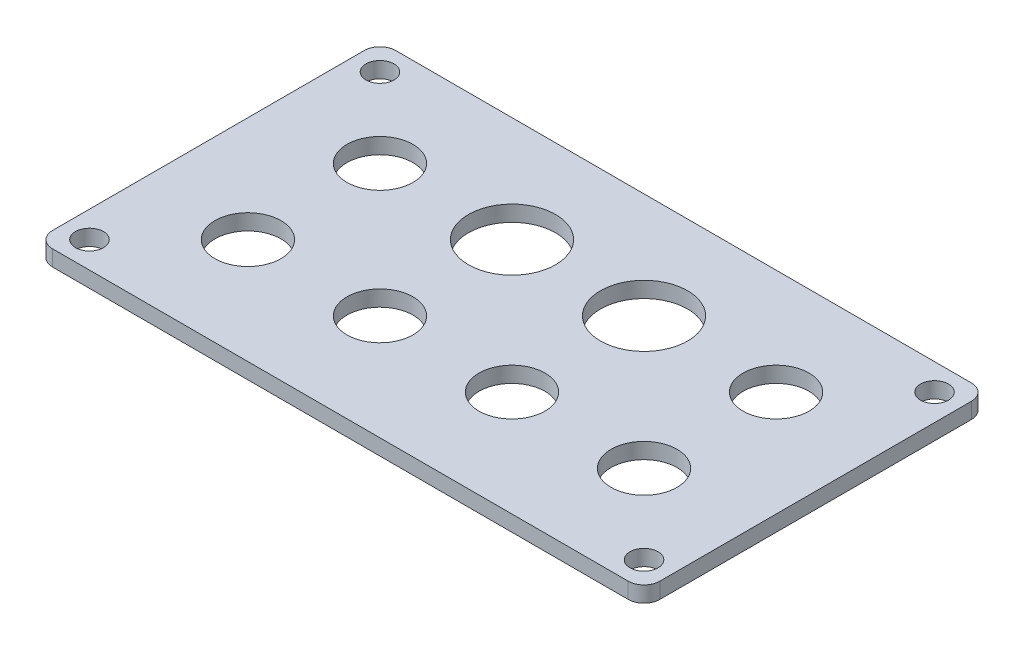
from build123d import *

# Parameters (mm, degrees)
SKETCH1_W            = 115
SKETCH1_H            = 65
BOSS_EXTRUDE1_DEPTH  = 3
SKETCH2_R            = 6.25
CUT_EXTRUDE1_DEPTH   = 3
LPATTERN1_COUNT      = 4
LPATTERN1_PITCH      = 25
LPATTERN1_COUNT_DIR2 = 2
LPATTERN1_PITCH_DIR2 = 25
SKETCH3_R            = 8.25
CUT_EXTRUDE2_DEPTH   = 3
M5_CLEARANCE_HOLE1_D = 5.3
FILLET1_R            = 3


with BuildPart() as part:
    # Sketch1 → Boss-Extrude1 (new body)
    with BuildSketch(Plane(origin=(0, 0, 0), x_dir=(1, 0, 0), z_dir=(0, 1, 0))):
        with Locations((57.5, 32.5)):
            Rectangle(SKETCH1_W, SKETCH1_H)
    extrude(amount=BOSS_EXTRUDE1_DEPTH)

    # Sketch2 → Cut-Extrude1 (cut)
    with BuildSketch(Plane(origin=(0, 3, 0), x_dir=(1, 0, 0), z_dir=(0, 1, 0))):
        with Locations(Location((20, 20, 0), (0, 0, 270))):
            Circle(SKETCH2_R)
    cut_extrude1 = extrude(amount=-CUT_EXTRUDE1_DEPTH, mode=Mode.SUBTRACT)

    # LPattern1: Cut-Extrude1 4 × 2, 2 skipped
    with Locations(*[(i * LPATTERN1_PITCH, 0, -j * LPATTERN1_PITCH_DIR2) for i in range(LPATTERN1_COUNT) for j in range(LPATTERN1_COUNT_DIR2) if (i, j) not in ((0, 0), (1, 1), (2, 1))]):
        add(cut_extrude1, mode=Mode.SUBTRACT)

    # Sketch3 → Cut-Extrude2 (cut)
    with BuildSketch(Plane(origin=(0, 3, 0), x_dir=(1, 0, 0), z_dir=(0, 1, 0))):
        with Locations(Location((45, 45, 0), (0, 0, 270))):
            Circle(SKETCH3_R)
        with Locations(Location((70, 45, 0), (0, 0, 270))):
            Circle(SKETCH3_R)
    extrude(amount=-CUT_EXTRUDE2_DEPTH, mode=Mode.SUBTRACT)

    # M5 Clearance Hole1 (through all)
    with Locations(Plane(origin=(0, 3, 0), x_dir=(1, 0, 0), z_dir=(0, 1, 0))):
        with Locations((5, 60), (5, 5), (110, 5), (110, 60)):
            Hole(M5_CLEARANCE_HOLE1_D / 2)

    # Fillet1
    fillet1_edges = [part.edges().sort_by_distance(p)[0] for p in [
        (0, 1.5, -65),
        (115, 1.5, -65),
        (115, 1.5, 0),
        (0, 1.5, 0),
    ]]
    fillet(fillet1_edges, radius=FILLET1_R)


solid = part.part
